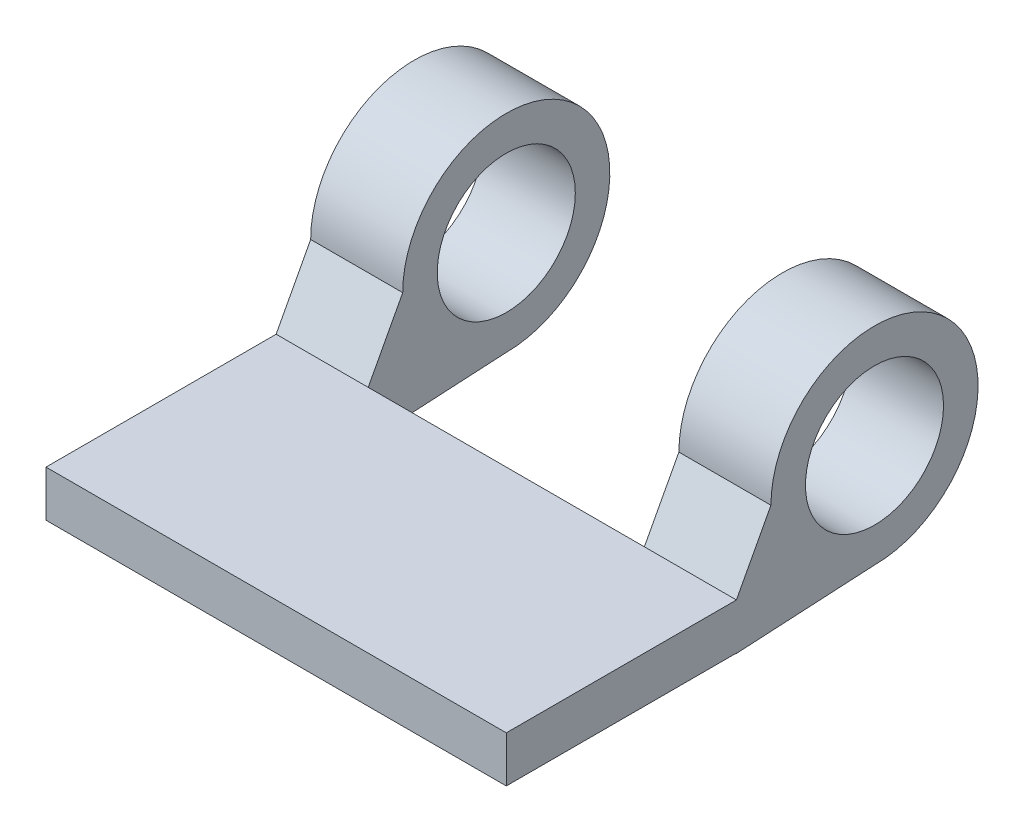
from build123d import *

# Parameters (mm, degrees)
SKETCH1_W           = 20
SKETCH1_H           = 10
BOSS_EXTRUDE1_DEPTH = 2
SKETCH4_R           = 3
BOSS_EXTRUDE2_DEPTH = 4


with BuildPart() as part:
    # Sketch1 → Boss-Extrude1 (new body)
    with BuildSketch(Plane(origin=(0, 0, 0), x_dir=(1, 0, 0), z_dir=(0, 1, 0))):
        with Locations((0, -5)):
            Rectangle(SKETCH1_W, SKETCH1_H)
    extrude(amount=BOSS_EXTRUDE1_DEPTH)

    # Sketch4 → Boss-Extrude2 (add)
    with BuildSketch(Plane(origin=(6, 0, 0), x_dir=(0, 0, -1), z_dir=(1, 0, 0))):
        with BuildLine():
            Line((0, 2), (1.5, 4.814384898))
            ThreePointArc((1.5, 4.814384898), (9.181980515, 7.996365414), (6, 0.314384898))
            Line((6, 0.314384898), (0, -0.014042226))
            Line((0, -0.014042226), (0, 2))
        make_face()
        with Locations((6, 4.814384898)):
            Circle(SKETCH4_R, mode=Mode.SUBTRACT)
    boss_extrude2 = extrude(amount=BOSS_EXTRUDE2_DEPTH)

    # Mirror1: Boss-Extrude2 across plane
    add(boss_extrude2.mirror(Plane(origin=(0, 0, 0), x_dir=(0, 0, 1), z_dir=(1, 0, 0))))


solid = part.part
